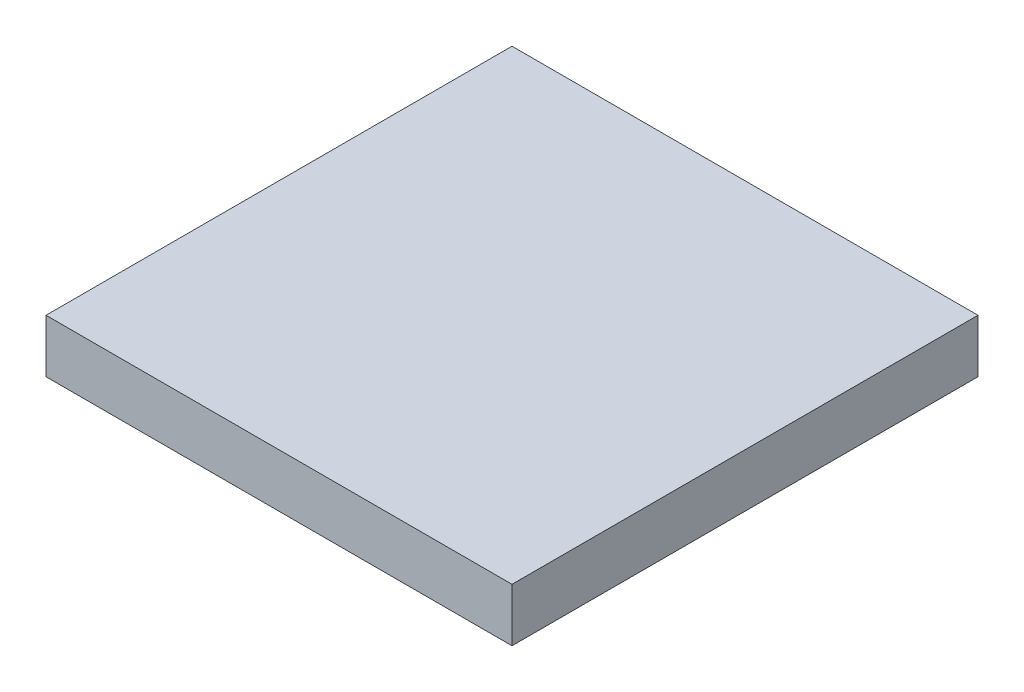
from build123d import *

# Parameters (mm, degrees)
SKETCH1_W           = 17.5
SKETCH1_H           = 17.5
BOSS_EXTRUDE1_DEPTH = 2


with BuildPart() as part:
    # Sketch1 → Boss-Extrude1 (new body)
    with BuildSketch(Plane(origin=(0, 0, 0), x_dir=(1, 0, 0), z_dir=(0, 1, 0))):
        with Locations((-16.779411765, 4.700980392)):
            Rectangle(SKETCH1_W, SKETCH1_H)
    extrude(amount=BOSS_EXTRUDE1_DEPTH)


solid = part.part
